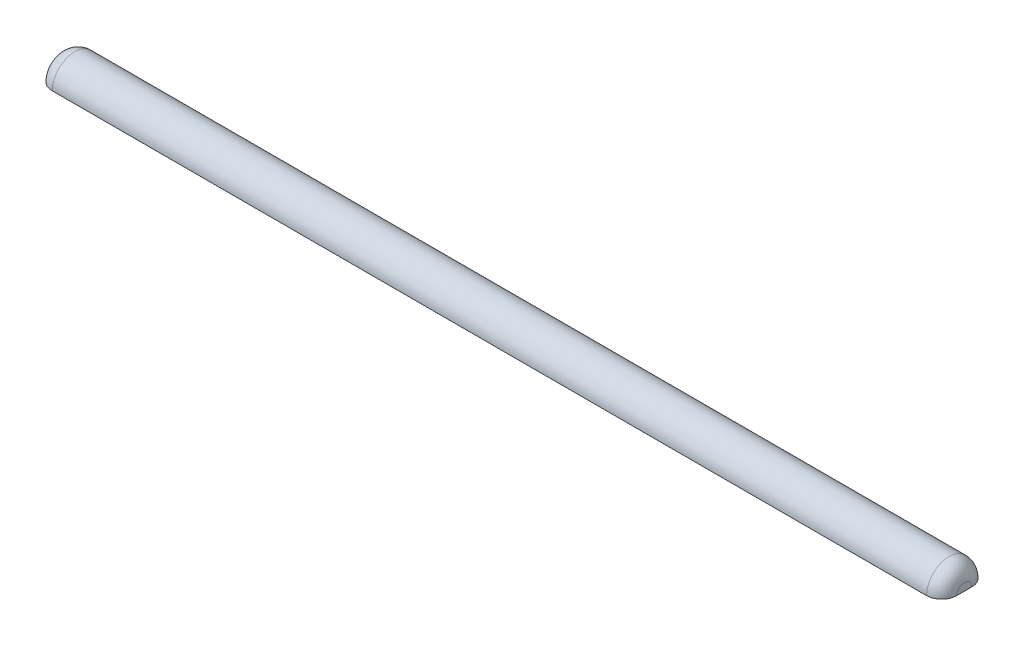
from build123d import *

# Parameters (mm, degrees)
BOSS_EXTRUDE1_DEPTH = 3
FILLET1_R           = 0.05


with BuildPart() as part:
    # Sketch1 → Boss-Extrude1 (new body)
    with BuildSketch(Plane(origin=(0, 0, 0), x_dir=(0, 0, -1), z_dir=(1, 0, 0))):
        with BuildLine():
            Line((0, 0), (0.15, 0))
            ThreePointArc((0.15, 0), (0.075, 0.075), (0, 0))
        make_face()
    extrude(amount=BOSS_EXTRUDE1_DEPTH)

    # Fillet1
    fillet1_edges = [part.edges().sort_by_distance(p)[0] for p in [
        (0, 0.075, -0.075),
        (3, 0.075, -0.075),
    ]]
    fillet(fillet1_edges, radius=FILLET1_R)


solid = part.part
